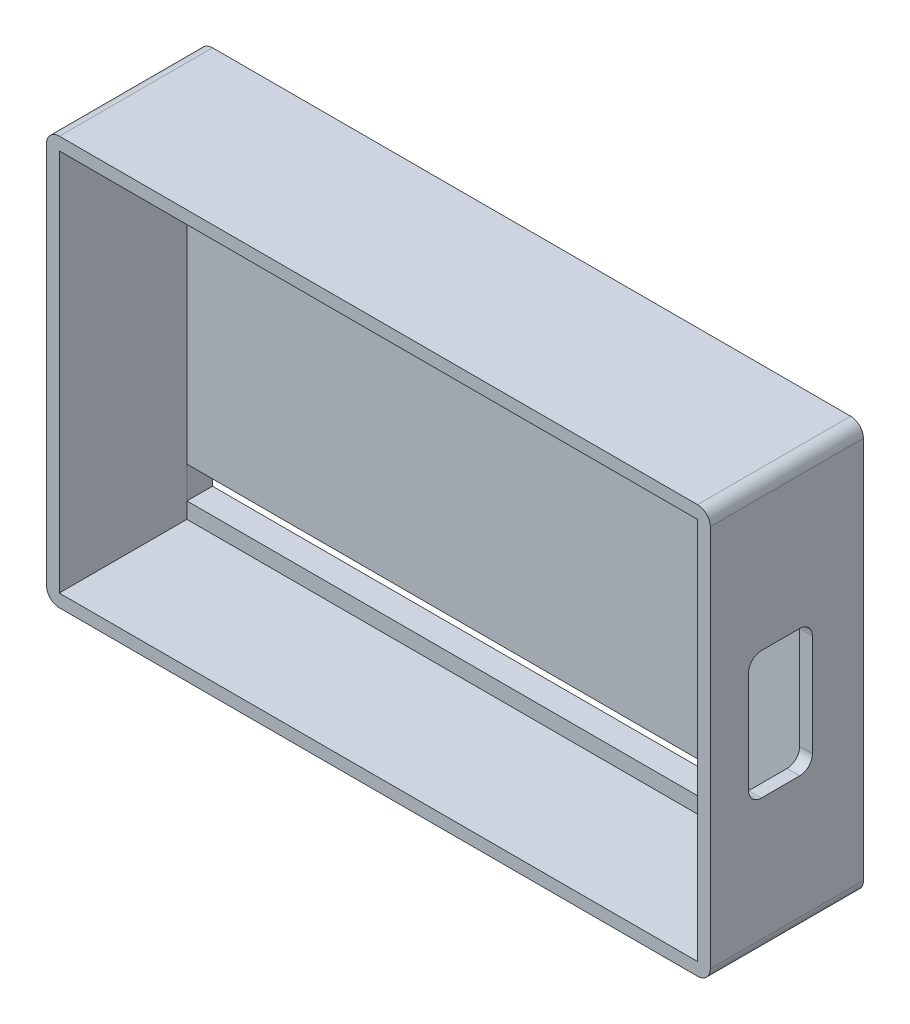
from build123d import *

# Parameters (mm, degrees)
SKETCH1_W           = 52
SKETCH1_H           = 32
SKETCH1_W_2         = 50
SKETCH1_H_2         = 2.5
BOSS_EXTRUDE1_DEPTH = 2
SKETCH2_W           = 52
SKETCH2_H           = 32
SKETCH2_W_2         = 50.00793432
SKETCH2_H_2         = 30
BOSS_EXTRUDE2_DEPTH = 10
SKETCH3_W           = 5
SKETCH3_H           = 10
CUT_EXTRUDE1_DEPTH  = 10
FILLET1_R           = 1
FILLET2_R           = 1
FILLET3_R           = 1
FILLET4_R           = 1
FILLET5_R           = 1
FILLET6_R           = 1
FILLET7_R           = 1
FILLET8_R           = 1


with BuildPart() as part:
    # Sketch1 → Boss-Extrude1 (new body)
    with BuildSketch(Plane.XY):
        Rectangle(SKETCH1_W, SKETCH1_H)
        with Locations((0, 12.5)):
            Rectangle(SKETCH1_W_2, SKETCH1_H_2, mode=Mode.SUBTRACT)
        with Locations((0, -12.5)):
            Rectangle(SKETCH1_W_2, SKETCH1_H_2, mode=Mode.SUBTRACT)
    extrude(amount=BOSS_EXTRUDE1_DEPTH)

    # Sketch2 → Boss-Extrude2 (add)
    with BuildSketch(Plane.XY.offset(2)):
        Rectangle(SKETCH2_W, SKETCH2_H)
        Rectangle(SKETCH2_W_2, SKETCH2_H_2, mode=Mode.SUBTRACT)
    extrude(amount=BOSS_EXTRUDE2_DEPTH)

    # Sketch3 → Cut-Extrude1 (cut)
    with BuildSketch(Plane(origin=(26, 0, 0), x_dir=(0, 0, -1), z_dir=(1, 0, 0))):
        with Locations((-6.5, -0.40632889)):
            Rectangle(SKETCH3_W, SKETCH3_H)
    extrude(amount=-CUT_EXTRUDE1_DEPTH, mode=Mode.SUBTRACT)

    # Fillet1
    fillet1_edges = [part.edges().sort_by_distance(p)[0] for p in [
        (26, 16, 6),
    ]]
    fillet(fillet1_edges, radius=FILLET1_R)

    # Fillet2
    fillet2_edges = [part.edges().sort_by_distance(p)[0] for p in [
        (26, -16, 6),
    ]]
    fillet(fillet2_edges, radius=FILLET2_R)

    # Fillet3
    fillet3_edges = [part.edges().sort_by_distance(p)[0] for p in [
        (-26, -16, 6),
    ]]
    fillet(fillet3_edges, radius=FILLET3_R)

    # Fillet4
    fillet4_edges = [part.edges().sort_by_distance(p)[0] for p in [
        (-26, 16, 6),
    ]]
    fillet(fillet4_edges, radius=FILLET4_R)

    # Fillet5
    fillet5_edges = [part.edges().sort_by_distance(p)[0] for p in [
        (25.50198358, 4.59367111, 4),
    ]]
    fillet(fillet5_edges, radius=FILLET5_R)

    # Fillet6
    fillet6_edges = [part.edges().sort_by_distance(p)[0] for p in [
        (25.50198358, -5.40632889, 4),
    ]]
    fillet(fillet6_edges, radius=FILLET6_R)

    # Fillet7
    fillet7_edges = [part.edges().sort_by_distance(p)[0] for p in [
        (25.50198358, -5.40632889, 9),
    ]]
    fillet(fillet7_edges, radius=FILLET7_R)

    # Fillet8
    fillet8_edges = [part.edges().sort_by_distance(p)[0] for p in [
        (25.50198358, 4.59367111, 9),
    ]]
    fillet(fillet8_edges, radius=FILLET8_R)


solid = part.part
